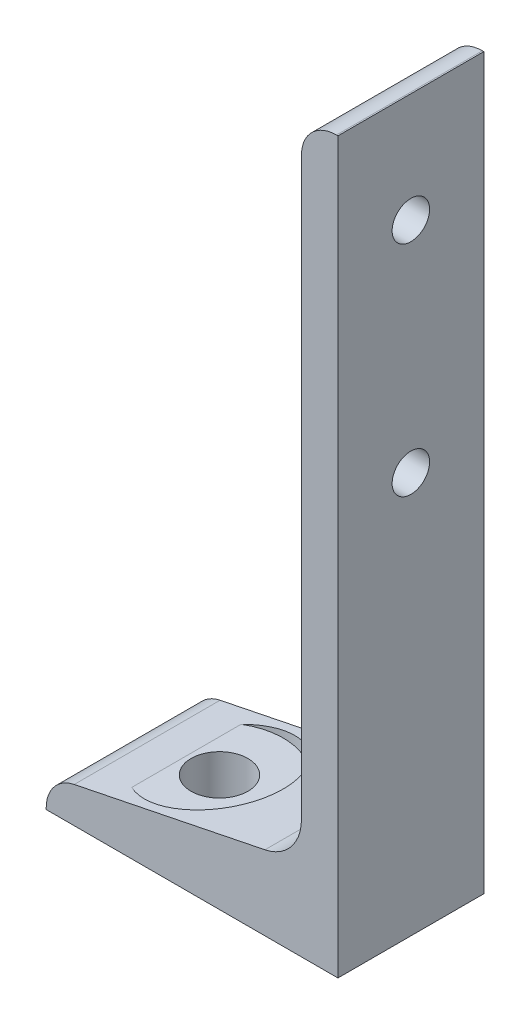
from build123d import *

# Parameters (mm, degrees)
EXTRUDE1_DEPTH     = 12.7
SKETCH5_R          = 3.2639
CUT_EXTRUDE1_DEPTH = 136.152108752
SKETCH6_R          = 4.953
CUT_EXTRUDE2_DEPTH = 131.359174591
SKETCH7_R          = 11.1125
CUT_EXTRUDE3_DEPTH = 131.359174591


with BuildPart() as part:
    # Sketch1 → Extrude1 (new, symmetric)
    with BuildSketch(Plane.XY):
        with BuildLine():
            Line((0, 127), (0, 0))
            Line((0, 0), (-50.8, 0))
            Line((-50.8, 0), (-50.8, 0.254))
            ThreePointArc((-50.8, 0.254), (-49.424543317, 4.111160457), (-45.918869163, 6.227718182))
            Line((-45.918869163, 6.227718182), (-12.70563911, 12.982259955))
            ThreePointArc((-12.70563911, 12.982259955), (-8.140959222, 15.738194493), (-6.35, 20.760538838))
            Line((-6.35, 20.760538838), (-6.35, 120.904))
            ThreePointArc((-6.35, 120.904), (-4.564522938, 125.214522938), (-0.254, 127))
            Line((-0.254, 127), (0, 127))
        make_face()
    extrude(amount=EXTRUDE1_DEPTH, both=True)

    # Sketch5 → Cut-Extrude1 (cut, through all)
    with BuildSketch(Plane.ZY.offset(6.35)):
        with Locations(Location((0, 69.85, 0), (0, 0, 270))):
            Circle(SKETCH5_R)
        with Locations(Location((0, 107.95, 0), (0, 0, 270))):
            Circle(SKETCH5_R)
    extrude(amount=-CUT_EXTRUDE1_DEPTH, mode=Mode.SUBTRACT)

    # Sketch6 → Cut-Extrude2 (cut, through all)
    with BuildSketch(Plane(origin=(0, 7.62, 0), x_dir=(-1, 0, 0), z_dir=(0, 1, 0))):
        with Locations(Location((33.3248, 0, 0), (0, 0, 90))):
            Circle(SKETCH6_R)
    extrude(amount=-CUT_EXTRUDE2_DEPTH, mode=Mode.SUBTRACT)

    # Sketch7 → Cut-Extrude3 (cut, through all)
    with BuildSketch(Plane(origin=(0, 7.62, 0), x_dir=(-1, 0, 0), z_dir=(0, 1, 0))):
        with Locations((33.3248, 0)):
            Circle(SKETCH7_R)
    extrude(amount=CUT_EXTRUDE3_DEPTH, mode=Mode.SUBTRACT)


solid = part.part
